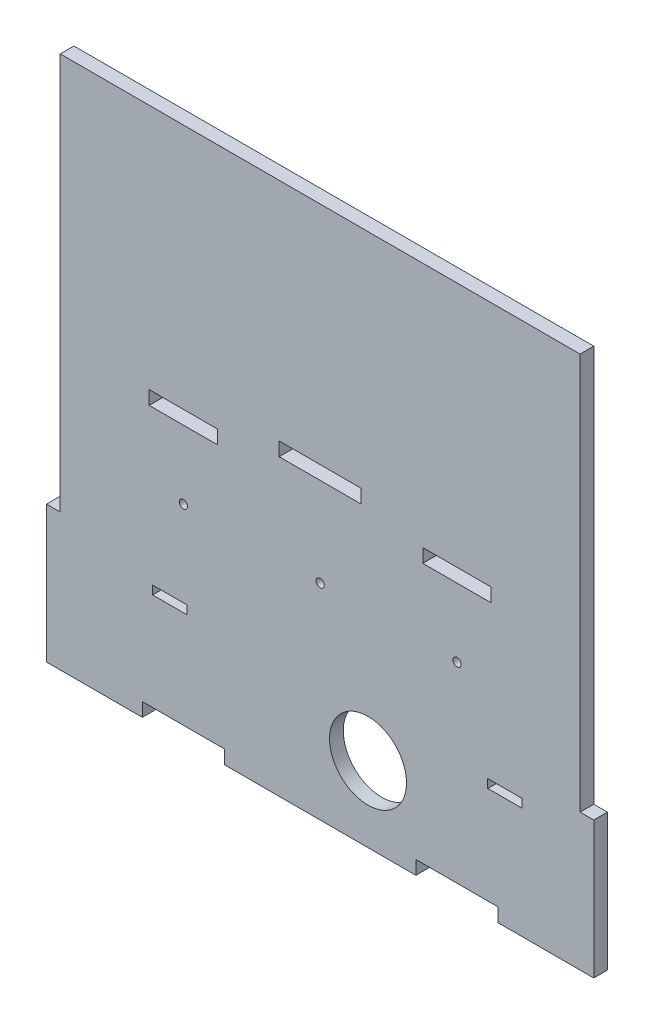
from build123d import *

# Parameters (mm, degrees)
SKETCH1_R           = 14.2875
SKETCH1_R_2         = 1.524
SKETCH1_W           = 25.4
SKETCH1_H           = 5.08
BOSS_EXTRUDE1_DEPTH = 5.08
SKETCH2_W           = 5.08
SKETCH2_H           = 50.8
BOSS_EXTRUDE2_DEPTH = 5.08
SKETCH3_W           = 30.48
SKETCH3_H           = 5.08
CUT_EXTRUDE1_DEPTH  = 5.08


with BuildPart() as part:
    # Sketch1 → Boss-Extrude1 (new body)
    with BuildSketch(Plane.XY):
        Polygon((96.52, 198.12), (-96.52, 198.12), (-96.52, 0), (-66.04, 0), (-66.04, 5.08), (-35.56, 5.08), (-35.56, 0), (35.56, 0), (35.56, 5.08), (66.04, 5.08), (66.04, 0), (96.52, 0), align=None)
        Polygon((-62.23, 44.45), (-55.88, 44.45), (-49.53, 44.45), (-49.53, 41.275), (-62.23, 41.275), align=None, mode=Mode.SUBTRACT)
        with Locations((17.78, 27.94)):
            Circle(SKETCH1_R, mode=Mode.SUBTRACT)
        Polygon((62.23, 44.45), (68.58, 44.45), (74.93, 44.45), (74.93, 41.275), (62.23, 41.275), align=None, mode=Mode.SUBTRACT)
        with Locations((-50.8, 76.2)):
            Circle(SKETCH1_R_2, mode=Mode.SUBTRACT)
        with BuildLine():
            ThreePointArc((0, 74.676), (-1.077630735, 75.122369265), (-1.524, 76.2))
            ThreePointArc((-1.524, 76.2), (-1.077630735, 77.277630735), (0, 77.724))
            ThreePointArc((0, 77.724), (1.077630735, 77.277630735), (1.524, 76.2))
            ThreePointArc((1.524, 76.2), (1.077630735, 75.122369265), (0, 74.676))
        make_face(mode=Mode.SUBTRACT)
        with Locations((-50.8, 104.14)):
            Rectangle(SKETCH1_W, SKETCH1_H, mode=Mode.SUBTRACT)
        with Locations((50.8, 76.2)):
            Circle(SKETCH1_R_2, mode=Mode.SUBTRACT)
        with Locations((50.8, 104.14)):
            Rectangle(SKETCH1_W, SKETCH1_H, mode=Mode.SUBTRACT)
    extrude(amount=BOSS_EXTRUDE1_DEPTH)

    # Sketch2 → Boss-Extrude2 (add)
    with BuildSketch(Plane.XY.offset(5.08)):
        with Locations((99.06, 25.4)):
            Rectangle(SKETCH2_W, SKETCH2_H)
        with Locations((-99.06, 25.4)):
            Rectangle(SKETCH2_W, SKETCH2_H)
    extrude(amount=-BOSS_EXTRUDE2_DEPTH)

    # Sketch3 → Cut-Extrude1 (cut)
    with BuildSketch(Plane.XY.offset(5.08)):
        with Locations((0, 111.76)):
            Rectangle(SKETCH3_W, SKETCH3_H)
    extrude(amount=-CUT_EXTRUDE1_DEPTH, mode=Mode.SUBTRACT)


solid = part.part
